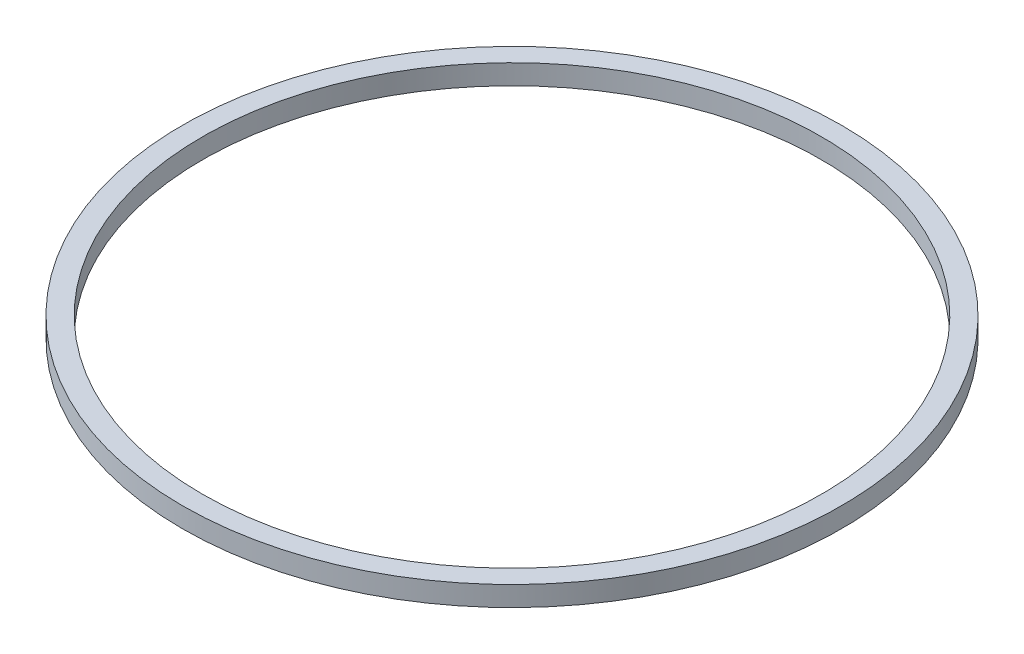
from build123d import *

# Parameters (mm, degrees)
SKETCH_1_R      = 33
SKETCH_1_R_2    = 31
EXTRUDE_1_DEPTH = 2


with BuildPart() as part:
    # Эскиз1 → Бобышка-Вытянуть1 (new body)
    with BuildSketch(Plane(origin=(0, 0, 0), x_dir=(1, 0, 0), z_dir=(0, 1, 0))):
        with Locations(Location((0, 0, 0), (0, 0, 270))):
            Circle(SKETCH_1_R)
        with Locations(Location((0, 0, 0), (0, 0, 270))):
            Circle(SKETCH_1_R_2, mode=Mode.SUBTRACT)
    extrude(amount=EXTRUDE_1_DEPTH)


solid = part.part
